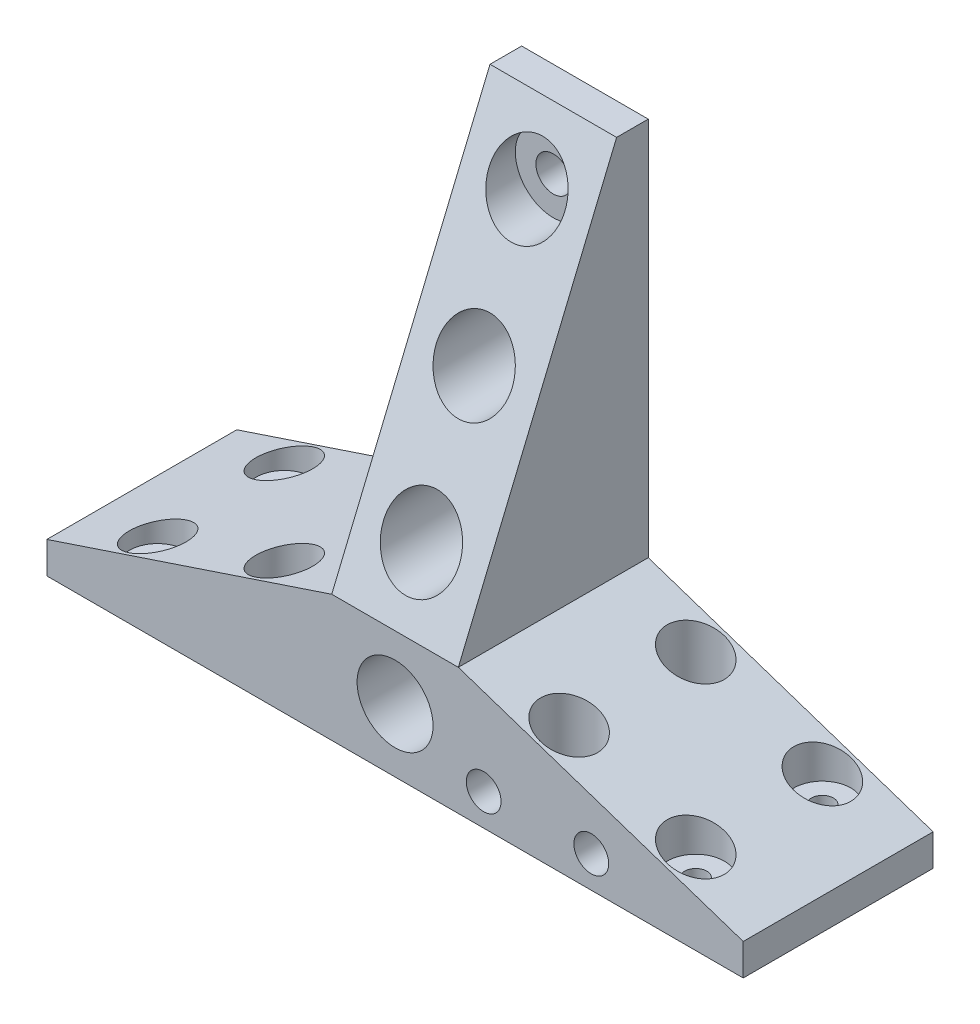
from build123d import *

# Parameters (mm, degrees)
ESQUISSE1_W             = 20
ESQUISSE1_H             = 80
ESQUISSE1_R             = 2.75
BOSS_EXTRU_1_DEPTH      = 5
BOSS_EXTRU_2_DEPTH      = 5
ESQUISSE4_R             = 2.75
BOSS_EXTRU_3_DEPTH      = 25
BOSS_EXTRU_4_DEPTH      = 20
ENL_V_MAT_EXTRU_1_REACH = 78.988
ESQUISSE6_R             = 6
ENL_V_MAT_EXTRU_2_REACH = 103.838
ESQUISSE7_R             = 1.75
ENL_V_MAT_EXTRU_3_REACH = 99.959
ESQUISSE9_R             = 4.5
ENL_V_MAT_EXTRU_4_REACH = 80.753
ESQUISSE10_R            = 2.75


with BuildPart() as part:
    # Esquisse1 → Boss.-Extru.1 (new body)
    with BuildSketch(Plane.XY):
        with Locations((0.415494059, -7.235772358)):
            Rectangle(ESQUISSE1_W, ESQUISSE1_H)
        with Locations((0.415494059, 22.764227642)):
            Circle(ESQUISSE1_R, mode=Mode.SUBTRACT)
        with Locations((0.415494059, -17.235772358)):
            Circle(ESQUISSE1_R, mode=Mode.SUBTRACT)
        with Locations((0.415494059, 2.764227642)):
            Circle(ESQUISSE1_R, mode=Mode.SUBTRACT)
        with Locations((0.415494059, -37.235772358)):
            Circle(ESQUISSE1_R, mode=Mode.SUBTRACT)
    extrude(amount=BOSS_EXTRU_1_DEPTH)

    # Esquisse3 → Boss.-Extru.2 (add)
    with BuildSketch(Plane.XY.offset(5)):
        Polygon((-9.584505941, -47.235772358), (-54.584505941, -47.235772358), (-54.584505941, -42.235772358), (-9.584505941, -27.235772358), align=None)
        Polygon((10.415494059, -47.235772358), (55.415494059, -47.235772358), (55.415494059, -42.235772358), (10.415494059, -27.235772358), align=None)
    extrude(amount=-BOSS_EXTRU_2_DEPTH)

    # Esquisse4 → Boss.-Extru.3 (add)
    with BuildSketch(Plane.XY.offset(5)):
        Polygon((55.415494059, -47.235772358), (55.415494059, -42.235772358), (10.415494059, -27.235772358), (-9.584505941, -27.235772358), (-54.584505941, -42.235772358), (-54.584505941, -47.235772358), align=None)
        with Locations((0.415494059, -37.235772358)):
            Circle(ESQUISSE4_R, mode=Mode.SUBTRACT)
    extrude(amount=BOSS_EXTRU_3_DEPTH)

    # Esquisse5 → Boss.-Extru.4 (add)
    with BuildSketch(Plane.ZY.offset(9.584505941)):
        Polygon((5, -27.235772358), (30, -27.235772358), (5, 32.764227642), align=None)
    extrude(amount=-BOSS_EXTRU_4_DEPTH)

    # Esquisse6 → Enlèv. mat.-Extru.1 (cut, up to next)
    with BuildSketch(Plane(origin=(0, 0, 5), x_dir=(-1, 0, 0), z_dir=(0, 0, -1)), mode=Mode.PRIVATE) as enl_v_mat_extru_1_sk1:
        with Locations((-0.415494059, 2.764227642)):
            Circle(ESQUISSE6_R)
    enl_v_mat_extru_1_tool1 = extrude(enl_v_mat_extru_1_sk1.sketch, amount=-ENL_V_MAT_EXTRU_1_REACH, mode=Mode.PRIVATE) & part.part
    # Esquisse6 → Enlèv. mat.-Extru.1 (cut, up to next)
    with BuildSketch(Plane(origin=(0, 0, 5), x_dir=(-1, 0, 0), z_dir=(0, 0, -1)), mode=Mode.PRIVATE) as enl_v_mat_extru_1_sk2:
        with Locations((-0.415494059, -17.235772358)):
            Circle(ESQUISSE6_R)
    enl_v_mat_extru_1_tool2 = extrude(enl_v_mat_extru_1_sk2.sketch, amount=-ENL_V_MAT_EXTRU_1_REACH, mode=Mode.PRIVATE) & part.part
    # Esquisse6 → Enlèv. mat.-Extru.1 (cut, up to next)
    with BuildSketch(Plane(origin=(0, 0, 5), x_dir=(-1, 0, 0), z_dir=(0, 0, -1)), mode=Mode.PRIVATE) as enl_v_mat_extru_1_sk3:
        with Locations((-0.415494059, 22.764227642)):
            Circle(ESQUISSE6_R)
    enl_v_mat_extru_1_tool3 = extrude(enl_v_mat_extru_1_sk3.sketch, amount=-ENL_V_MAT_EXTRU_1_REACH, mode=Mode.PRIVATE) & part.part
    # Esquisse6 → Enlèv. mat.-Extru.1 (cut, up to next)
    with BuildSketch(Plane(origin=(0, 0, 5), x_dir=(-1, 0, 0), z_dir=(0, 0, -1)), mode=Mode.PRIVATE) as enl_v_mat_extru_1_sk4:
        with Locations((-0.415494059, -37.235772358)):
            Circle(ESQUISSE6_R)
    enl_v_mat_extru_1_tool4 = extrude(enl_v_mat_extru_1_sk4.sketch, amount=-ENL_V_MAT_EXTRU_1_REACH, mode=Mode.PRIVATE) & part.part
    add(enl_v_mat_extru_1_tool1.solids().sort_by_distance((0.415494, 2.764228, 5))[0], mode=Mode.SUBTRACT)
    add(enl_v_mat_extru_1_tool2.solids().sort_by_distance((0.415494, -17.235772, 5))[0], mode=Mode.SUBTRACT)
    add(enl_v_mat_extru_1_tool3.solids().sort_by_distance((0.415494, 22.764228, 5))[0], mode=Mode.SUBTRACT)
    add(enl_v_mat_extru_1_tool4.solids().sort_by_distance((0.415494, -37.235772, 5))[0], mode=Mode.SUBTRACT)

    # Esquisse7 → Enlèv. mat.-Extru.2 (cut, up to next)
    with BuildSketch(Plane.XZ.offset(47.235772358), mode=Mode.PRIVATE) as enl_v_mat_extru_2_sk1:
        with Locations(Location((-42.084505941, 25, 0), (0, 0, 270))):
            Circle(ESQUISSE7_R)
    enl_v_mat_extru_2_tool1 = extrude(enl_v_mat_extru_2_sk1.sketch, amount=-ENL_V_MAT_EXTRU_2_REACH, mode=Mode.PRIVATE) & part.part
    # Esquisse7 → Enlèv. mat.-Extru.2 (cut, up to next)
    with BuildSketch(Plane.XZ.offset(47.235772358), mode=Mode.PRIVATE) as enl_v_mat_extru_2_sk2:
        with Locations(Location((-22.084505941, 25, 0), (0, 0, 270))):
            Circle(ESQUISSE7_R)
    enl_v_mat_extru_2_tool2 = extrude(enl_v_mat_extru_2_sk2.sketch, amount=-ENL_V_MAT_EXTRU_2_REACH, mode=Mode.PRIVATE) & part.part
    # Esquisse7 → Enlèv. mat.-Extru.2 (cut, up to next)
    with BuildSketch(Plane.XZ.offset(47.235772358), mode=Mode.PRIVATE) as enl_v_mat_extru_2_sk3:
        with Locations(Location((-22.084505941, 5, 0), (0, 0, 270))):
            Circle(ESQUISSE7_R)
    enl_v_mat_extru_2_tool3 = extrude(enl_v_mat_extru_2_sk3.sketch, amount=-ENL_V_MAT_EXTRU_2_REACH, mode=Mode.PRIVATE) & part.part
    # Esquisse7 → Enlèv. mat.-Extru.2 (cut, up to next)
    with BuildSketch(Plane.XZ.offset(47.235772358), mode=Mode.PRIVATE) as enl_v_mat_extru_2_sk4:
        with Locations(Location((-42.084505941, 5, 0), (0, 0, 270))):
            Circle(ESQUISSE7_R)
    enl_v_mat_extru_2_tool4 = extrude(enl_v_mat_extru_2_sk4.sketch, amount=-ENL_V_MAT_EXTRU_2_REACH, mode=Mode.PRIVATE) & part.part
    # Esquisse7 → Enlèv. mat.-Extru.2 (cut, up to next)
    with BuildSketch(Plane.XZ.offset(47.235772358), mode=Mode.PRIVATE) as enl_v_mat_extru_2_sk5:
        with Locations(Location((42.915494059, 25, 0), (0, 0, 270))):
            Circle(ESQUISSE7_R)
    enl_v_mat_extru_2_tool5 = extrude(enl_v_mat_extru_2_sk5.sketch, amount=-ENL_V_MAT_EXTRU_2_REACH, mode=Mode.PRIVATE) & part.part
    # Esquisse7 → Enlèv. mat.-Extru.2 (cut, up to next)
    with BuildSketch(Plane.XZ.offset(47.235772358), mode=Mode.PRIVATE) as enl_v_mat_extru_2_sk6:
        with Locations(Location((42.915494059, 5, 0), (0, 0, 270))):
            Circle(ESQUISSE7_R)
    enl_v_mat_extru_2_tool6 = extrude(enl_v_mat_extru_2_sk6.sketch, amount=-ENL_V_MAT_EXTRU_2_REACH, mode=Mode.PRIVATE) & part.part
    # Esquisse7 → Enlèv. mat.-Extru.2 (cut, up to next)
    with BuildSketch(Plane.XZ.offset(47.235772358), mode=Mode.PRIVATE) as enl_v_mat_extru_2_sk7:
        with Locations(Location((22.915494059, 5, 0), (0, 0, 270))):
            Circle(ESQUISSE7_R)
    enl_v_mat_extru_2_tool7 = extrude(enl_v_mat_extru_2_sk7.sketch, amount=-ENL_V_MAT_EXTRU_2_REACH, mode=Mode.PRIVATE) & part.part
    # Esquisse7 → Enlèv. mat.-Extru.2 (cut, up to next)
    with BuildSketch(Plane.XZ.offset(47.235772358), mode=Mode.PRIVATE) as enl_v_mat_extru_2_sk8:
        with Locations(Location((22.915494059, 25, 0), (0, 0, 270))):
            Circle(ESQUISSE7_R)
    enl_v_mat_extru_2_tool8 = extrude(enl_v_mat_extru_2_sk8.sketch, amount=-ENL_V_MAT_EXTRU_2_REACH, mode=Mode.PRIVATE) & part.part
    add(enl_v_mat_extru_2_tool1.solids().sort_by_distance((-42.084506, -47.235772, 25))[0], mode=Mode.SUBTRACT)
    add(enl_v_mat_extru_2_tool2.solids().sort_by_distance((-22.084506, -47.235772, 25))[0], mode=Mode.SUBTRACT)
    add(enl_v_mat_extru_2_tool3.solids().sort_by_distance((-22.084506, -47.235772, 5))[0], mode=Mode.SUBTRACT)
    add(enl_v_mat_extru_2_tool4.solids().sort_by_distance((-42.084506, -47.235772, 5))[0], mode=Mode.SUBTRACT)
    add(enl_v_mat_extru_2_tool5.solids().sort_by_distance((42.915494, -47.235772, 25))[0], mode=Mode.SUBTRACT)
    add(enl_v_mat_extru_2_tool6.solids().sort_by_distance((42.915494, -47.235772, 5))[0], mode=Mode.SUBTRACT)
    add(enl_v_mat_extru_2_tool7.solids().sort_by_distance((22.915494, -47.235772, 5))[0], mode=Mode.SUBTRACT)
    add(enl_v_mat_extru_2_tool8.solids().sort_by_distance((22.915494, -47.235772, 25))[0], mode=Mode.SUBTRACT)

    # Esquisse9 → Enlèv. mat.-Extru.3 (cut, up to next)
    with BuildSketch(Plane(origin=(0, -42.235772358, 0), x_dir=(-1, 0, 0), z_dir=(0, -1, 0)), mode=Mode.PRIVATE) as enl_v_mat_extru_3_sk1:
        with Locations(Location((42.084505941, -25, 0), (0, 0, 90))):
            Circle(ESQUISSE9_R)
    enl_v_mat_extru_3_tool1 = extrude(enl_v_mat_extru_3_sk1.sketch, amount=-ENL_V_MAT_EXTRU_3_REACH, mode=Mode.PRIVATE) & part.part
    # Esquisse9 → Enlèv. mat.-Extru.3 (cut, up to next)
    with BuildSketch(Plane(origin=(0, -42.235772358, 0), x_dir=(-1, 0, 0), z_dir=(0, -1, 0)), mode=Mode.PRIVATE) as enl_v_mat_extru_3_sk2:
        with Locations(Location((22.084505941, -25, 0), (0, 0, 90))):
            Circle(ESQUISSE9_R)
    enl_v_mat_extru_3_tool2 = extrude(enl_v_mat_extru_3_sk2.sketch, amount=-ENL_V_MAT_EXTRU_3_REACH, mode=Mode.PRIVATE) & part.part
    # Esquisse9 → Enlèv. mat.-Extru.3 (cut, up to next)
    with BuildSketch(Plane(origin=(0, -42.235772358, 0), x_dir=(-1, 0, 0), z_dir=(0, -1, 0)), mode=Mode.PRIVATE) as enl_v_mat_extru_3_sk3:
        with Locations(Location((22.084505941, -5, 0), (0, 0, 90))):
            Circle(ESQUISSE9_R)
    enl_v_mat_extru_3_tool3 = extrude(enl_v_mat_extru_3_sk3.sketch, amount=-ENL_V_MAT_EXTRU_3_REACH, mode=Mode.PRIVATE) & part.part
    # Esquisse9 → Enlèv. mat.-Extru.3 (cut, up to next)
    with BuildSketch(Plane(origin=(0, -42.235772358, 0), x_dir=(-1, 0, 0), z_dir=(0, -1, 0)), mode=Mode.PRIVATE) as enl_v_mat_extru_3_sk4:
        with Locations(Location((42.084505941, -5, 0), (0, 0, 90))):
            Circle(ESQUISSE9_R)
    enl_v_mat_extru_3_tool4 = extrude(enl_v_mat_extru_3_sk4.sketch, amount=-ENL_V_MAT_EXTRU_3_REACH, mode=Mode.PRIVATE) & part.part
    # Esquisse9 → Enlèv. mat.-Extru.3 (cut, up to next)
    with BuildSketch(Plane(origin=(0, -42.235772358, 0), x_dir=(-1, 0, 0), z_dir=(0, -1, 0)), mode=Mode.PRIVATE) as enl_v_mat_extru_3_sk5:
        with Locations(Location((-22.915494059, -25, 0), (0, 0, 90))):
            Circle(ESQUISSE9_R)
    enl_v_mat_extru_3_tool5 = extrude(enl_v_mat_extru_3_sk5.sketch, amount=-ENL_V_MAT_EXTRU_3_REACH, mode=Mode.PRIVATE) & part.part
    # Esquisse9 → Enlèv. mat.-Extru.3 (cut, up to next)
    with BuildSketch(Plane(origin=(0, -42.235772358, 0), x_dir=(-1, 0, 0), z_dir=(0, -1, 0)), mode=Mode.PRIVATE) as enl_v_mat_extru_3_sk6:
        with Locations(Location((-42.915494059, -25, 0), (0, 0, 90))):
            Circle(ESQUISSE9_R)
    enl_v_mat_extru_3_tool6 = extrude(enl_v_mat_extru_3_sk6.sketch, amount=-ENL_V_MAT_EXTRU_3_REACH, mode=Mode.PRIVATE) & part.part
    # Esquisse9 → Enlèv. mat.-Extru.3 (cut, up to next)
    with BuildSketch(Plane(origin=(0, -42.235772358, 0), x_dir=(-1, 0, 0), z_dir=(0, -1, 0)), mode=Mode.PRIVATE) as enl_v_mat_extru_3_sk7:
        with Locations(Location((-42.915494059, -5, 0), (0, 0, 90))):
            Circle(ESQUISSE9_R)
    enl_v_mat_extru_3_tool7 = extrude(enl_v_mat_extru_3_sk7.sketch, amount=-ENL_V_MAT_EXTRU_3_REACH, mode=Mode.PRIVATE) & part.part
    # Esquisse9 → Enlèv. mat.-Extru.3 (cut, up to next)
    with BuildSketch(Plane(origin=(0, -42.235772358, 0), x_dir=(-1, 0, 0), z_dir=(0, -1, 0)), mode=Mode.PRIVATE) as enl_v_mat_extru_3_sk8:
        with Locations(Location((-22.915494059, -5, 0), (0, 0, 90))):
            Circle(ESQUISSE9_R)
    enl_v_mat_extru_3_tool8 = extrude(enl_v_mat_extru_3_sk8.sketch, amount=-ENL_V_MAT_EXTRU_3_REACH, mode=Mode.PRIVATE) & part.part
    add(enl_v_mat_extru_3_tool1.solids().sort_by_distance((-42.084506, -42.235772, 25))[0], mode=Mode.SUBTRACT)
    add(enl_v_mat_extru_3_tool2.solids().sort_by_distance((-22.084506, -42.235772, 25))[0], mode=Mode.SUBTRACT)
    add(enl_v_mat_extru_3_tool3.solids().sort_by_distance((-22.084506, -42.235772, 5))[0], mode=Mode.SUBTRACT)
    add(enl_v_mat_extru_3_tool4.solids().sort_by_distance((-42.084506, -42.235772, 5))[0], mode=Mode.SUBTRACT)
    add(enl_v_mat_extru_3_tool5.solids().sort_by_distance((22.915494, -42.235772, 25))[0], mode=Mode.SUBTRACT)
    add(enl_v_mat_extru_3_tool6.solids().sort_by_distance((42.915494, -42.235772, 25))[0], mode=Mode.SUBTRACT)
    add(enl_v_mat_extru_3_tool7.solids().sort_by_distance((42.915494, -42.235772, 5))[0], mode=Mode.SUBTRACT)
    add(enl_v_mat_extru_3_tool8.solids().sort_by_distance((22.915494, -42.235772, 5))[0], mode=Mode.SUBTRACT)

    # Esquisse10 → Enlèv. mat.-Extru.4 (cut, up to next)
    with BuildSketch(Plane.XY.offset(30), mode=Mode.PRIVATE) as enl_v_mat_extru_4_sk1:
        with Locations((14.415494059, -42.235772358)):
            Circle(ESQUISSE10_R)
    enl_v_mat_extru_4_tool1 = extrude(enl_v_mat_extru_4_sk1.sketch, amount=-ENL_V_MAT_EXTRU_4_REACH, mode=Mode.PRIVATE) & part.part
    # Esquisse10 → Enlèv. mat.-Extru.4 (cut, up to next)
    with BuildSketch(Plane.XY.offset(30), mode=Mode.PRIVATE) as enl_v_mat_extru_4_sk2:
        with Locations((31.415494059, -42.235772358)):
            Circle(ESQUISSE10_R)
    enl_v_mat_extru_4_tool2 = extrude(enl_v_mat_extru_4_sk2.sketch, amount=-ENL_V_MAT_EXTRU_4_REACH, mode=Mode.PRIVATE) & part.part
    add(enl_v_mat_extru_4_tool1.solids().sort_by_distance((14.415494, -42.235772, 30))[0], mode=Mode.SUBTRACT)
    add(enl_v_mat_extru_4_tool2.solids().sort_by_distance((31.415494, -42.235772, 30))[0], mode=Mode.SUBTRACT)


solid = part.part
